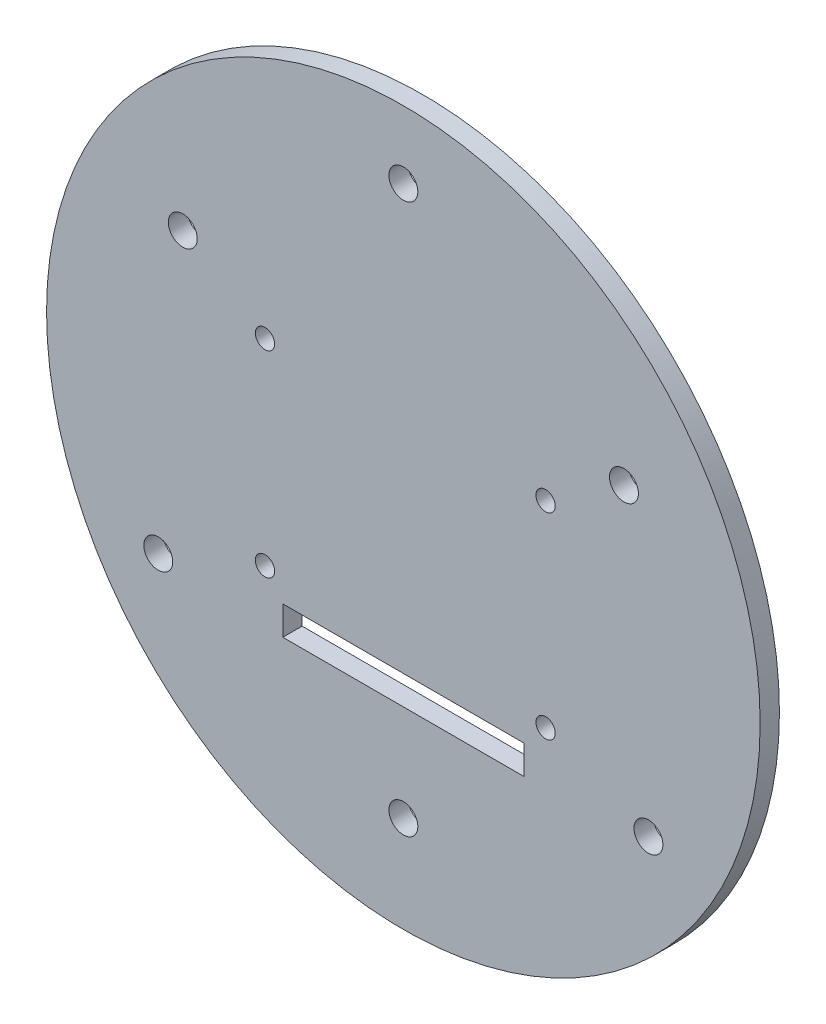
from build123d import *

# Parameters (mm, degrees)
ESQUISSE1_R             = 37
ESQUISSE1_R_2           = 1.5
ESQUISSE1_W             = 25
ESQUISSE1_H             = 3
BOSS_EXTRU_1_DEPTH      = 2
BOSS_EXTRU_2_DEPTH      = 15
ESQUISSE3_W             = 2
ESQUISSE3_H             = 28.4
BOSS_EXTRU_3_DEPTH      = 2.25
ESQUISSE5_W             = 2
ESQUISSE5_H             = 24.4
BOSS_EXTRU_4_DEPTH      = 2.25
ESQUISSE7_W             = 33.1
ESQUISSE7_H             = 28.4
BOSS_EXTRU_5_DEPTH      = 1
ESQUISSE8_W             = 15
ESQUISSE8_H             = 15
ENL_V_MAT_EXTRU_1_DEPTH = 3
ESQUISSE9_W             = 21
ESQUISSE9_H             = 2.5
ENL_V_MAT_EXTRU_2_DEPTH = 3
ESQUISSE10_R            = 1
ENL_V_MAT_EXTRU_3_DEPTH = 19
ESQUISSE11_W            = 33.1
ESQUISSE11_H            = 28.4
ENL_V_MAT_EXTRU_4_DEPTH = 15


with BuildPart() as part:
    # Esquisse1 → Boss.-Extru.1 (new body)
    with BuildSketch(Plane.XY):
        Circle(ESQUISSE1_R)
        with Locations((0, 30)):
            Circle(ESQUISSE1_R_2, mode=Mode.SUBTRACT)
        with Locations((-22.874807889, 14.34375)):
            Circle(ESQUISSE1_R_2, mode=Mode.SUBTRACT)
        with Locations((-25.416453209, -15.9375)):
            Circle(ESQUISSE1_R_2, mode=Mode.SUBTRACT)
        with Locations((0, -27)):
            Circle(ESQUISSE1_R_2, mode=Mode.SUBTRACT)
        with Locations((25.416453209, -15.9375)):
            Circle(ESQUISSE1_R_2, mode=Mode.SUBTRACT)
        with Locations((22.874807889, 14.34375)):
            Circle(ESQUISSE1_R_2, mode=Mode.SUBTRACT)
        with Locations((0, -15.5)):
            Rectangle(ESQUISSE1_W, ESQUISSE1_H, mode=Mode.SUBTRACT)
    extrude(amount=BOSS_EXTRU_1_DEPTH)

    # Esquisse2 → Boss.-Extru.2 (add)
    with BuildSketch(Plane(origin=(0, 0, 0), x_dir=(-1, 0, 0), z_dir=(0, 0, -1))):
        Polygon((-16.75, 14.9), (-12.75, 14.9), (-12.75, -9.5), (12.35, -9.5), (12.35, 14.9), (16.35, 14.9), (16.35, -13.5), (-16.75, -13.5), align=None)
    extrude(amount=BOSS_EXTRU_2_DEPTH)

    # Esquisse3 → Boss.-Extru.3 (add)
    with BuildSketch(Plane(origin=(-12.35, 0, 0), x_dir=(0, 0, -1), z_dir=(1, 0, 0))):
        with Locations((9.625, 0.7)):
            Rectangle(ESQUISSE3_W, ESQUISSE3_H)
        with Locations((6.625, 0.7)):
            Rectangle(ESQUISSE3_W, ESQUISSE3_H)
    extrude(amount=BOSS_EXTRU_3_DEPTH)

    # Esquisse5 → Boss.-Extru.4 (add)
    with BuildSketch(Plane.ZY.offset(-12.75)):
        with Locations((-9.625, 2.7)):
            Rectangle(ESQUISSE5_W, ESQUISSE5_H)
        with Locations((-6.625, 2.7)):
            Rectangle(ESQUISSE5_W, ESQUISSE5_H)
    extrude(amount=BOSS_EXTRU_4_DEPTH)

    # Esquisse7 → Boss.-Extru.5 (add)
    with BuildSketch(Plane(origin=(0, 0, -15), x_dir=(-1, 0, 0), z_dir=(0, 0, -1))):
        with Locations((-0.2, 0.7)):
            Rectangle(ESQUISSE7_W, ESQUISSE7_H)
    extrude(amount=-BOSS_EXTRU_5_DEPTH)

    # Esquisse8 → Enlèv. mat.-Extru.1 (cut)
    with BuildSketch(Plane(origin=(0, 0, -15), x_dir=(-1, 0, 0), z_dir=(0, 0, -1))):
        Rectangle(ESQUISSE8_W, ESQUISSE8_H)
    extrude(amount=-ENL_V_MAT_EXTRU_1_DEPTH, mode=Mode.SUBTRACT)

    # Esquisse9 → Enlèv. mat.-Extru.2 (cut)
    with BuildSketch(Plane.XZ.offset(13.5)):
        with Locations((0, -5.65)):
            Rectangle(ESQUISSE9_W, ESQUISSE9_H)
    extrude(amount=-ENL_V_MAT_EXTRU_2_DEPTH, mode=Mode.SUBTRACT)

    # Esquisse10 → Enlèv. mat.-Extru.3 (cut)
    with BuildSketch(Plane.XY.offset(2)):
        with Locations((-14.35, 8.9)):
            Circle(ESQUISSE10_R)
        with Locations((-14.35, -11.5)):
            Circle(ESQUISSE10_R)
        with Locations((14.75, -11.5)):
            Circle(ESQUISSE10_R)
        with Locations((14.75, 8.9)):
            Circle(ESQUISSE10_R)
    extrude(amount=-ENL_V_MAT_EXTRU_3_DEPTH, mode=Mode.SUBTRACT)

    # Esquisse11 → Enlèv. mat.-Extru.4 (cut)
    with BuildSketch(Plane(origin=(0, 0, -15), x_dir=(-1, 0, 0), z_dir=(0, 0, -1))):
        with Locations((-0.2, 0.7)):
            Rectangle(ESQUISSE11_W, ESQUISSE11_H)
    extrude(amount=-ENL_V_MAT_EXTRU_4_DEPTH, mode=Mode.SUBTRACT)


solid = part.part
